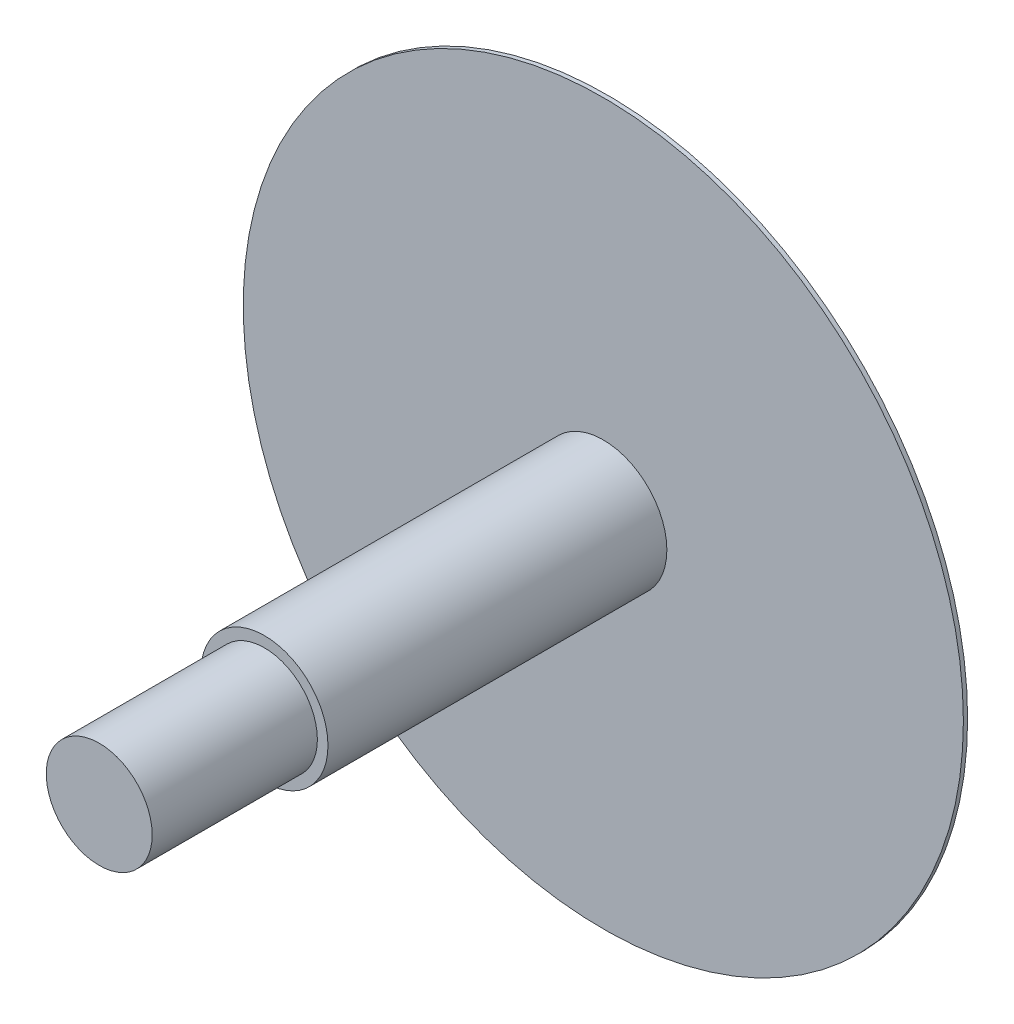
from build123d import *

# Parameters (mm, degrees)
SKETCH_1_R      = 85
SKETCH_1_R_2    = 15
EXTRUDE_1_DEPTH = 1
SKETCH_1_3_R    = 15
EXTRUDE_2_DEPTH = 81
SKETCH_1_4_R    = 12.5
EXTRUDE_3_DEPTH = 120


with BuildPart() as part:
    # 草图1 → 凸台-拉伸1 (new body)
    with BuildSketch(Plane.XY):
        Circle(SKETCH_1_R)
        Circle(SKETCH_1_R_2, mode=Mode.SUBTRACT)
    extrude(amount=EXTRUDE_1_DEPTH)

    # 草图1<3> → 凸台-拉伸2 (add)
    with BuildSketch(Plane.XY):
        Circle(SKETCH_1_3_R)
    extrude(amount=EXTRUDE_2_DEPTH)

    # 草图1<4> → 凸台-拉伸3 (add)
    with BuildSketch(Plane.XY):
        Circle(SKETCH_1_4_R)
    extrude(amount=EXTRUDE_3_DEPTH)


solid = part.part
